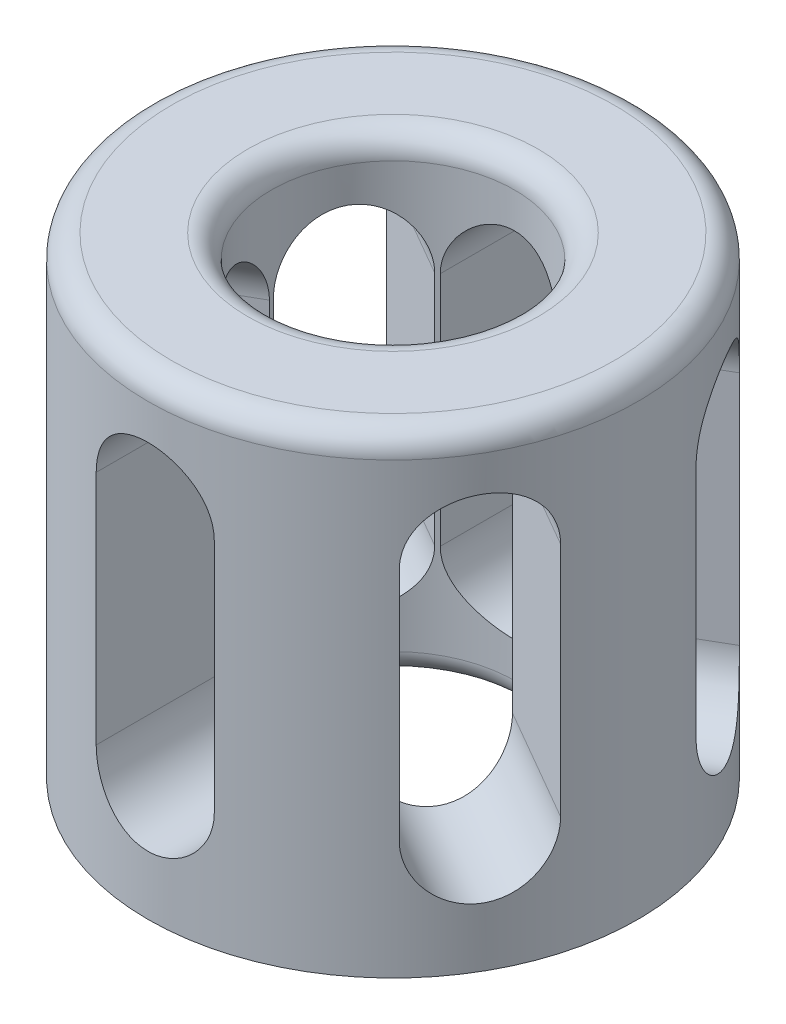
from build123d import *

# Parameters (mm, degrees)
SKETCH1_R           = 20.75
SKETCH1_R_2         = 10.3
BOSS_EXTRUDE1_DEPTH = 40
SKETCH2_W           = 10
SKETCH2_H           = 20
CUT_EXTRUDE1_DEPTH  = 20
CIRPATTERN1_COUNT   = 6
FILLET1_R           = 2


with BuildPart() as part:
    # Sketch1 → Boss-Extrude1 (new body)
    with BuildSketch(Plane(origin=(0, 0, 0), x_dir=(1, 0, 0), z_dir=(0, 1, 0))):
        with Locations(Location((0, 0, 0), (0, 0, 270))):
            Circle(SKETCH1_R)
        with Locations(Location((0, 0, 0), (0, 0, 270))):
            Circle(SKETCH1_R_2, mode=Mode.SUBTRACT)
    extrude(amount=BOSS_EXTRUDE1_DEPTH)

    # Sketch2 → Cut-Extrude1 (cut)
    with BuildSketch(Plane.XY.offset(20.75)):
        with BuildLine():
            Line((-5, 10), (5, 10))
            ThreePointArc((5, 10), (0, 5), (-5, 10))
        make_face()
        with Locations((0, 20)):
            Rectangle(SKETCH2_W, SKETCH2_H)
        with BuildLine():
            ThreePointArc((-5, 30), (0, 35), (5, 30))
            Line((5, 30), (-5, 30))
        make_face()
    cut_extrude1 = extrude(amount=-CUT_EXTRUDE1_DEPTH, mode=Mode.SUBTRACT)

    # CirPattern1: Cut-Extrude1 ×6 about axis
    cirpattern1_axis = Axis((0, 0, 0), (0, 1, 0))
    for i in range(1, CIRPATTERN1_COUNT):
        add(cut_extrude1.rotate(cirpattern1_axis, i * 360 / CIRPATTERN1_COUNT), mode=Mode.SUBTRACT)

    # Fillet1
    fillet1_edges = [part.edges().sort_by_distance(p)[0] for p in [
        (0, 40, -20.75),
        (0, 0, -10.3),
        (0, 40, -10.3),
    ]]
    fillet(fillet1_edges, radius=FILLET1_R)


solid = part.part
